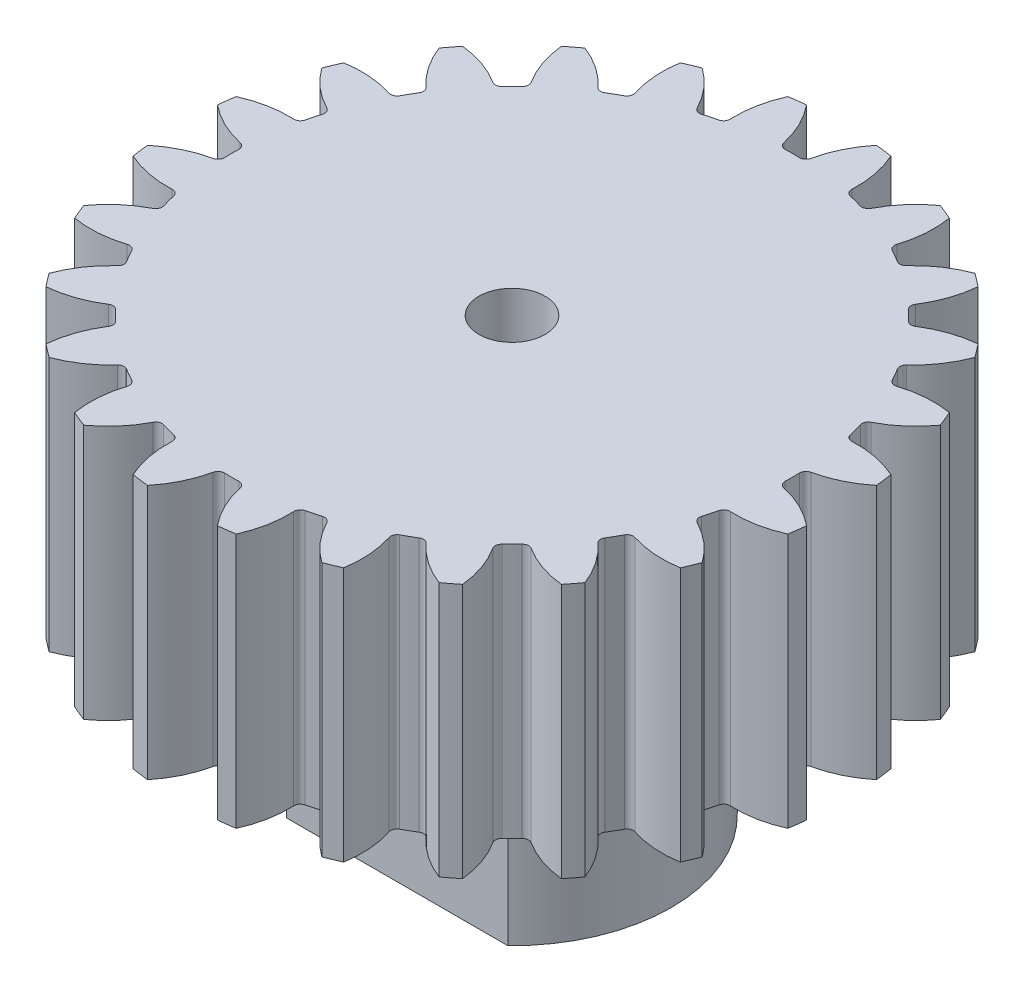
from build123d import *

# Parameters (mm, degrees)
SKETCH_1_R               = 26
EXTRUDE_1_DEPTH          = 20
SKETCH_2_R               = 12.5
EXTRUDE_2_DEPTH          = 14
CUT_EXTRUDE_1_REACH      = 43.857
PATTERN_CIRCULAR_1_COUNT = 24
CUT_EXTRUDE_4_DEPTH      = 42.676911108
CUT_EXTRUDE_4_DEPTH_BACK = 42.676911108
SKETCH_7_R               = 2.15
CUT_EXTRUDE_2_DEPTH      = 42.676911108
CUT_EXTRUDE_2_DEPTH_BACK = 42.676911108
SKETCH_5_R               = 2.6
CUT_EXTRUDE_START        = -12.5
SKETCH_8_W               = 25
SKETCH_8_H               = 14
CUT_EXTRUDE_5_DEPTH      = 3.5
CUT_EXTRUDE_START_2      = 12.5
SKETCH_8_2_W             = 25
SKETCH_8_2_H             = 14
CUT_EXTRUDE_6_DEPTH      = 3.5


with BuildPart() as part:
    # 草图1 → 凸台-拉伸1 (new body)
    with BuildSketch(Plane(origin=(0, 0, 0), x_dir=(1, 0, 0), z_dir=(0, 1, 0))):
        Circle(SKETCH_1_R)
    extrude(amount=EXTRUDE_1_DEPTH)

    # 草图2 → 凸台-拉伸2 (add)
    with BuildSketch(Plane(origin=(0, 0, 0), x_dir=(1, 0, 0), z_dir=(0, 1, 0))):
        Circle(SKETCH_2_R)
    extrude(amount=-EXTRUDE_2_DEPTH)

    # 草图4 → 切除-拉伸1 (cut, up to next)
    with BuildSketch(Plane(origin=(0, 0, 0), x_dir=(1, 0, 0), z_dir=(0, 1, 0)), mode=Mode.PRIVATE) as cut_extrude_1_sk1:
        with BuildLine():
            ThreePointArc((2.741813312, 25.855027746), (1.695394394, 24.220742425), (1.06187474, 22.386475838))
            ThreePointArc((1.06187474, 22.386475838), (0.882061796, 22.099428872), (0.560547841, 21.992857616))
            ThreePointArc((0.560547841, 21.992857616), (0, 22), (-0.560547841, 21.992857616))
            ThreePointArc((-0.560547841, 21.992857616), (-0.882061796, 22.099428872), (-1.06187474, 22.386475838))
            ThreePointArc((-1.06187474, 22.386475838), (-1.695394394, 24.220742425), (-2.741813312, 25.855027746))
            ThreePointArc((-2.741813312, 25.855027746), (0, 26), (2.741813312, 25.855027746))
        make_face()
    cut_extrude_1_tool1 = extrude(cut_extrude_1_sk1.sketch, amount=CUT_EXTRUDE_1_REACH, mode=Mode.PRIVATE) & part.part
    cut_extrude_1 = cut_extrude_1_tool1.solids().sort_by_distance((0, 0, -24.336645))[0]
    add(cut_extrude_1, mode=Mode.SUBTRACT)

    # 阵列(圆周)1: 切除-拉伸1 ×24 about axis
    pattern_circular_1_axis = Axis((0, 20, 0), (0, 1, 0))
    for i in range(1, PATTERN_CIRCULAR_1_COUNT):
        add(cut_extrude_1.rotate(pattern_circular_1_axis, i * 360 / PATTERN_CIRCULAR_1_COUNT), mode=Mode.SUBTRACT)

    # 草图7 → 切除-拉伸4 (cut, two sides: drawn at the far end of the back side and taken through both)
    with BuildSketch(Plane.XY.offset(-CUT_EXTRUDE_4_DEPTH_BACK)):
        with Locations((-4.5, -7)):
            Circle(SKETCH_7_R)
        with Locations((4.5, -7)):
            Circle(SKETCH_7_R)
    extrude(amount=CUT_EXTRUDE_4_DEPTH + CUT_EXTRUDE_4_DEPTH_BACK, mode=Mode.SUBTRACT)

    # 草图5 → 切除-拉伸2 (cut, two sides: drawn at the far end of the back side and taken through both)
    with BuildSketch(Plane(origin=(0, 0, 0), x_dir=(1, 0, 0), z_dir=(0, 1, 0)).offset(-CUT_EXTRUDE_2_DEPTH_BACK)):
        Circle(SKETCH_5_R)
    extrude(amount=CUT_EXTRUDE_2_DEPTH + CUT_EXTRUDE_2_DEPTH_BACK, mode=Mode.SUBTRACT)

    # 草图8 → 切除-拉伸5 (cut)
    with BuildSketch(Plane.XY.offset(CUT_EXTRUDE_START)):
        with Locations((0, -7)):
            Rectangle(SKETCH_8_W, SKETCH_8_H)
    extrude(amount=CUT_EXTRUDE_5_DEPTH, mode=Mode.SUBTRACT)

    # 草图8<2> → 切除-拉伸6 (cut)
    with BuildSketch(Plane.XY.offset(CUT_EXTRUDE_START_2)):
        with Locations((0, -7)):
            Rectangle(SKETCH_8_2_W, SKETCH_8_2_H)
    extrude(amount=-CUT_EXTRUDE_6_DEPTH, mode=Mode.SUBTRACT)


solid = part.part
